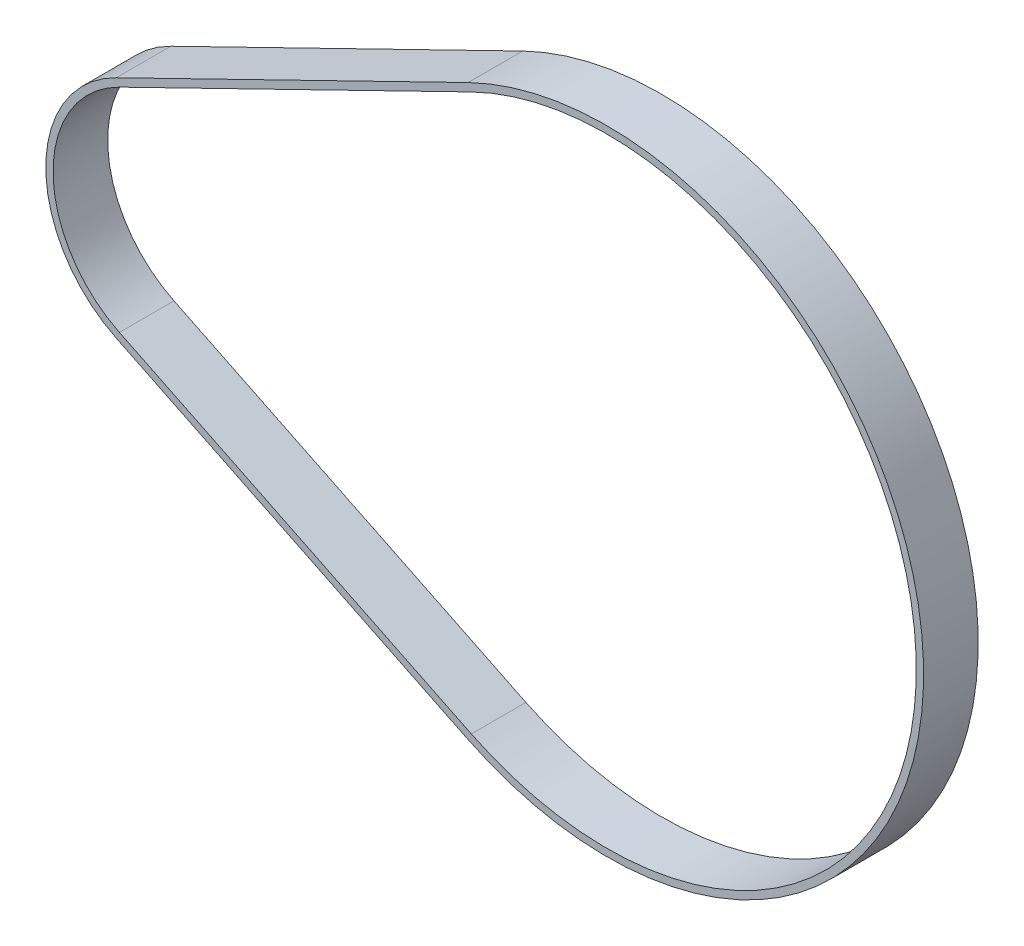
from build123d import *

# Parameters (mm, degrees)
EXTRUDE_1_DEPTH      = 3
EXTRUDE_1_DEPTH_BACK = 3


with BuildPart() as part:
    # 草图1 → 凸台-拉伸1 (new, two sides: drawn at the far end of the back side and taken through both)
    with BuildSketch(Plane.XY.offset(-EXTRUDE_1_DEPTH_BACK)):
        with BuildLine():
            Line((-6.048545797, -12.390498432), (32.625436737, -31.269590002))
            ThreePointArc((32.625436737, -31.269590002), (82.6864675, 0), (32.625436737, 31.269590002))
            Line((32.625436737, 31.269590002), (-6.048545797, 12.390498432))
            ThreePointArc((-6.048545797, 12.390498432), (-13.788015, 0), (-6.048545797, -12.390498432))
        make_face()
        with BuildLine():
            Line((-5.697600672, -11.671584306), (32.976381862, -30.550675876))
            ThreePointArc((32.976381862, -30.550675876), (81.8864675, 0), (32.976381862, 30.550675876))
            Line((32.976381862, 30.550675876), (-5.697600672, 11.671584306))
            ThreePointArc((-5.697600672, 11.671584306), (-12.988015, 0), (-5.697600672, -11.671584306))
        make_face(mode=Mode.SUBTRACT)
    extrude(amount=EXTRUDE_1_DEPTH + EXTRUDE_1_DEPTH_BACK)


solid = part.part
